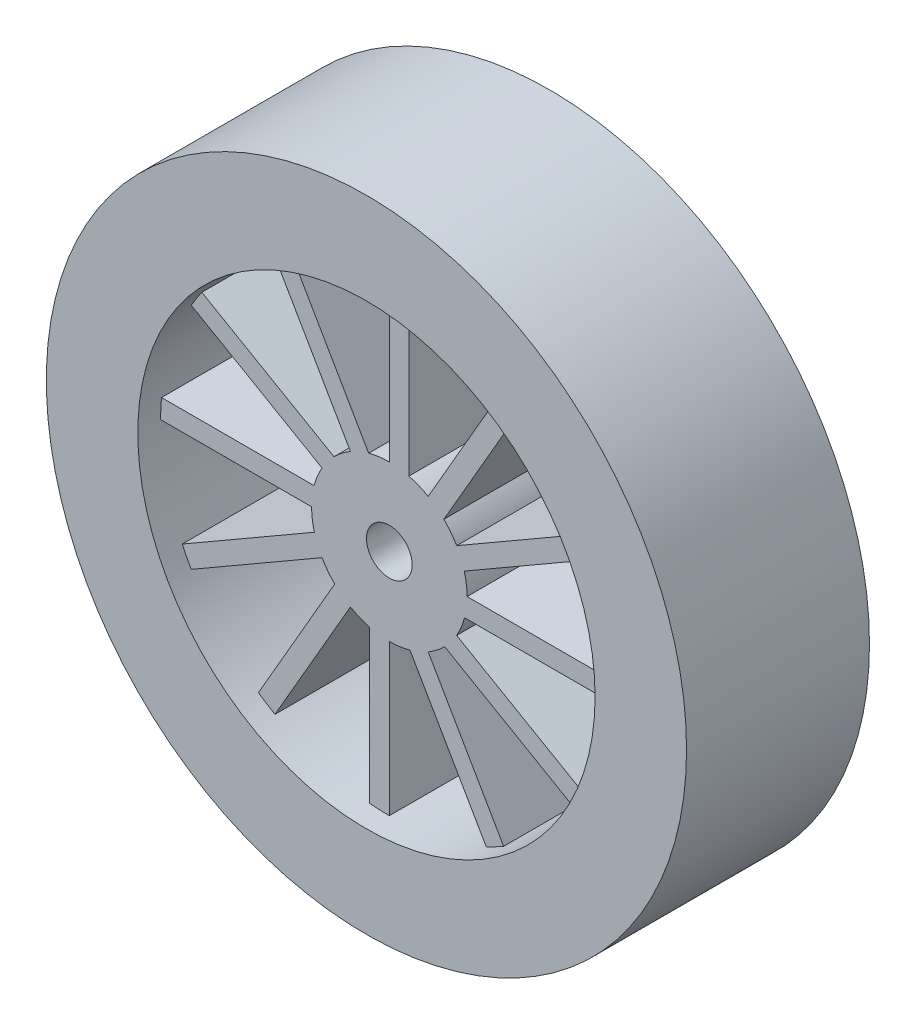
from build123d import *

# Parameters (mm, degrees)
BOSS_EXTRUDE1_DEPTH    = 7.5
BOSS_EXTRUDE1_2_DEPTH  = 7.5
BOSS_EXTRUDE1_3_DEPTH  = 7.5
BOSS_EXTRUDE1_4_DEPTH  = 7.5
BOSS_EXTRUDE1_5_DEPTH  = 7.5
BOSS_EXTRUDE1_6_DEPTH  = 7.5
BOSS_EXTRUDE1_7_DEPTH  = 7.5
BOSS_EXTRUDE1_8_DEPTH  = 7.5
BOSS_EXTRUDE1_9_DEPTH  = 7.5
BOSS_EXTRUDE1_10_DEPTH = 7.5
BOSS_EXTRUDE1_11_DEPTH = 7.5
BOSS_EXTRUDE1_12_DEPTH = 7.5
SKETCH1_3_R            = 27
BOSS_EXTRUDE2_DEPTH    = 10
SKETCH1_4_R            = 7.5
BOSS_EXTRUDE3_DEPTH    = 7.5
SKETCH1_5_R            = 35
SKETCH1_5_R_2          = 27
BOSS_EXTRUDE4_DEPTH    = 10
SKETCH1_6_R            = 7.5
SKETCH1_6_R_2          = 2.5
BOSS_EXTRUDE5_DEPTH    = 7.5


with BuildPart() as part:
    # Sketch1 → Boss-Extrude1 (new, symmetric)
    with BuildSketch(Plane.XY):
        with BuildLine():
            Line((-25, 0), (-8.5, 0))
            ThreePointArc((-8.5, 0), (-8.43117662, 1.079472466), (-8.225820987, 2.141464239))
            Line((-8.225820987, 2.141464239), (-24.908113757, 2.141464239))
            ThreePointArc((-24.908113757, 2.141464239), (-24.977017876, 1.071717333), (-25, 0))
        make_face()
    extrude(amount=BOSS_EXTRUDE1_DEPTH, both=True)



with BuildPart() as body_2:
    # Sketch1 → Boss-Extrude1 2 (new, symmetric)
    with BuildSketch(Plane.XY):
        with BuildLine():
            ThreePointArc((-7.361215932, -4.25), (-7.84134937, -3.280737732), (-8.194502061, -2.258348061))
            Line((-8.194502061, -2.258348061), (-22.641791393, -10.599494446))
            ThreePointArc((-22.641791393, -10.599494446), (-22.166590658, -11.560374502), (-21.650635095, -12.5))
            Line((-21.650635095, -12.5), (-7.361215932, -4.25))
        make_face()
    extrude(amount=BOSS_EXTRUDE1_2_DEPTH, both=True)


with BuildPart() as body_3:
    # Sketch1 → Boss-Extrude1 3 (new, symmetric)
    with BuildSketch(Plane.XY):
        with BuildLine():
            Line((-21.650635095, 12.5), (-7.361215932, 4.25))
            ThreePointArc((-7.361215932, 4.25), (-6.761876904, 5.150438888), (-6.053037822, 5.967472926))
            Line((-6.053037822, 5.967472926), (-20.500327154, 14.308619311))
            ThreePointArc((-20.500327154, 14.308619311), (-21.094873324, 13.416643374), (-21.650635095, 12.5))
        make_face()
    extrude(amount=BOSS_EXTRUDE1_3_DEPTH, both=True)


with BuildPart() as body_4:
    # Sketch1 → Boss-Extrude1 4 (new, symmetric)
    with BuildSketch(Plane.XY):
        with BuildLine():
            ThreePointArc((-4.25, -7.361215932), (-5.150438888, -6.761876904), (-5.967472926, -6.053037822))
            Line((-5.967472926, -6.053037822), (-14.308619311, -20.500327154))
            ThreePointArc((-14.308619311, -20.500327154), (-13.416643374, -21.094873324), (-12.5, -21.650635095))
            Line((-12.5, -21.650635095), (-4.25, -7.361215932))
        make_face()
    extrude(amount=BOSS_EXTRUDE1_4_DEPTH, both=True)


with BuildPart() as body_5:
    # Sketch1 → Boss-Extrude1 5 (new, symmetric)
    with BuildSketch(Plane.XY):
        with BuildLine():
            Line((-12.5, 21.650635095), (-4.25, 7.361215932))
            ThreePointArc((-4.25, 7.361215932), (-3.280737732, 7.84134937), (-2.258348061, 8.194502061))
            Line((-2.258348061, 8.194502061), (-10.599494446, 22.641791393))
            ThreePointArc((-10.599494446, 22.641791393), (-11.560374502, 22.166590658), (-12.5, 21.650635095))
        make_face()
    extrude(amount=BOSS_EXTRUDE1_5_DEPTH, both=True)


with BuildPart() as body_6:
    # Sketch1 → Boss-Extrude1 6 (new, symmetric)
    with BuildSketch(Plane.XY):
        with BuildLine():
            ThreePointArc((0, -8.5), (-1.079472466, -8.43117662), (-2.141464239, -8.225820987))
            Line((-2.141464239, -8.225820987), (-2.141464239, -24.908113757))
            ThreePointArc((-2.141464239, -24.908113757), (-1.071717333, -24.977017876), (0, -25))
            Line((0, -25), (0, -8.5))
        make_face()
    extrude(amount=BOSS_EXTRUDE1_6_DEPTH, both=True)


with BuildPart() as body_7:
    # Sketch1 → Boss-Extrude1 7 (new, symmetric)
    with BuildSketch(Plane.XY):
        with BuildLine():
            Line((0, 25), (0, 8.5))
            ThreePointArc((0, 8.5), (1.079472466, 8.43117662), (2.141464239, 8.225820987))
            Line((2.141464239, 8.225820987), (2.141464239, 24.908113757))
            ThreePointArc((2.141464239, 24.908113757), (1.071717333, 24.977017876), (0, 25))
        make_face()
    extrude(amount=BOSS_EXTRUDE1_7_DEPTH, both=True)


with BuildPart() as body_8:
    # Sketch1 → Boss-Extrude1 8 (new, symmetric)
    with BuildSketch(Plane.XY):
        with BuildLine():
            ThreePointArc((4.25, -7.361215932), (3.280737732, -7.84134937), (2.258348061, -8.194502061))
            Line((2.258348061, -8.194502061), (10.599494446, -22.641791393))
            ThreePointArc((10.599494446, -22.641791393), (11.560374502, -22.166590658), (12.5, -21.650635095))
            Line((12.5, -21.650635095), (4.25, -7.361215932))
        make_face()
    extrude(amount=BOSS_EXTRUDE1_8_DEPTH, both=True)


with BuildPart() as body_9:
    # Sketch1 → Boss-Extrude1 9 (new, symmetric)
    with BuildSketch(Plane.XY):
        with BuildLine():
            Line((12.5, 21.650635095), (4.25, 7.361215932))
            ThreePointArc((4.25, 7.361215932), (5.150438888, 6.761876904), (5.967472926, 6.053037822))
            Line((5.967472926, 6.053037822), (14.308619311, 20.500327154))
            ThreePointArc((14.308619311, 20.500327154), (13.416643374, 21.094873324), (12.5, 21.650635095))
        make_face()
    extrude(amount=BOSS_EXTRUDE1_9_DEPTH, both=True)


with BuildPart() as body_10:
    # Sketch1 → Boss-Extrude1 10 (new, symmetric)
    with BuildSketch(Plane.XY):
        with BuildLine():
            ThreePointArc((7.361215932, -4.25), (6.761876904, -5.150438888), (6.053037822, -5.967472926))
            Line((6.053037822, -5.967472926), (20.500327154, -14.308619311))
            ThreePointArc((20.500327154, -14.308619311), (21.094873324, -13.416643374), (21.650635095, -12.5))
            Line((21.650635095, -12.5), (7.361215932, -4.25))
        make_face()
    extrude(amount=BOSS_EXTRUDE1_10_DEPTH, both=True)


with BuildPart() as body_11:
    # Sketch1 → Boss-Extrude1 11 (new, symmetric)
    with BuildSketch(Plane.XY):
        with BuildLine():
            Line((21.650635095, 12.5), (7.361215932, 4.25))
            ThreePointArc((7.361215932, 4.25), (7.84134937, 3.280737732), (8.194502061, 2.258348061))
            Line((8.194502061, 2.258348061), (22.641791393, 10.599494446))
            ThreePointArc((22.641791393, 10.599494446), (22.166590658, 11.560374502), (21.650635095, 12.5))
        make_face()
    extrude(amount=BOSS_EXTRUDE1_11_DEPTH, both=True)


with BuildPart() as body_12:
    # Sketch1 → Boss-Extrude1 12 (new, symmetric)
    with BuildSketch(Plane.XY):
        with BuildLine():
            ThreePointArc((8.5, 0), (8.43117662, -1.079472466), (8.225820987, -2.141464239))
            Line((8.225820987, -2.141464239), (24.908113757, -2.141464239))
            ThreePointArc((24.908113757, -2.141464239), (24.977017876, -1.071717333), (25, 0))
            Line((25, 0), (8.5, 0))
        make_face()
    extrude(amount=BOSS_EXTRUDE1_12_DEPTH, both=True)


with BuildPart() as part_1:
    add(part.part)

    add(body_2.part)  # Boss-Extrude2 merges body 2

    add(body_3.part)  # Boss-Extrude2 merges body 3

    add(body_4.part)  # Boss-Extrude2 merges body 4

    add(body_5.part)  # Boss-Extrude2 merges body 5

    add(body_6.part)  # Boss-Extrude2 merges body 6

    add(body_7.part)  # Boss-Extrude2 merges body 7

    add(body_8.part)  # Boss-Extrude2 merges body 8

    add(body_9.part)  # Boss-Extrude2 merges body 9

    add(body_10.part)  # Boss-Extrude2 merges body 10

    add(body_11.part)  # Boss-Extrude2 merges body 11

    add(body_12.part)  # Boss-Extrude2 merges body 12
    # Sketch1<3> → Boss-Extrude2 (add, symmetric)
    with BuildSketch(Plane.XY):
        Circle(SKETCH1_3_R)
        with BuildLine():
            ThreePointArc((-22.641791393, -10.599494446), (-24.403327487, -5.429328465), (-25, 0))
            ThreePointArc((-25, 0), (-24.977017876, 1.071717333), (-24.908113757, 2.141464239))
            ThreePointArc((-24.908113757, 2.141464239), (-23.848565773, 7.499727367), (-21.650635095, 12.5))
            ThreePointArc((-21.650635095, 12.5), (-21.094873324, 13.416643374), (-20.500327154, 14.308619311))
            ThreePointArc((-20.500327154, 14.308619311), (-16.90360012, 18.419237307), (-12.5, 21.650635095))
            ThreePointArc((-12.5, 21.650635095), (-11.560374502, 22.166590658), (-10.599494446, 22.641791393))
            ThreePointArc((-10.599494446, 22.641791393), (-5.429328465, 24.403327487), (0, 25))
            ThreePointArc((0, 25), (1.071717333, 24.977017876), (2.141464239, 24.908113757))
            ThreePointArc((2.141464239, 24.908113757), (7.499727367, 23.848565773), (12.5, 21.650635095))
            ThreePointArc((12.5, 21.650635095), (13.416643374, 21.094873324), (14.308619311, 20.500327154))
            ThreePointArc((14.308619311, 20.500327154), (18.419237307, 16.90360012), (21.650635095, 12.5))
            ThreePointArc((21.650635095, 12.5), (22.166590658, 11.560374502), (22.641791393, 10.599494446))
            ThreePointArc((22.641791393, 10.599494446), (24.403327487, 5.429328465), (25, 0))
            ThreePointArc((25, 0), (24.977017876, -1.071717333), (24.908113757, -2.141464239))
            ThreePointArc((24.908113757, -2.141464239), (23.848565773, -7.499727367), (21.650635095, -12.5))
            ThreePointArc((21.650635095, -12.5), (21.094873324, -13.416643374), (20.500327154, -14.308619311))
            ThreePointArc((20.500327154, -14.308619311), (16.90360012, -18.419237307), (12.5, -21.650635095))
            ThreePointArc((12.5, -21.650635095), (11.560374502, -22.166590658), (10.599494446, -22.641791393))
            ThreePointArc((10.599494446, -22.641791393), (5.429328465, -24.403327487), (0, -25))
            ThreePointArc((0, -25), (-1.071717333, -24.977017876), (-2.141464239, -24.908113757))
            ThreePointArc((-2.141464239, -24.908113757), (-7.499727367, -23.848565773), (-12.5, -21.650635095))
            ThreePointArc((-12.5, -21.650635095), (-13.416643374, -21.094873324), (-14.308619311, -20.500327154))
            ThreePointArc((-14.308619311, -20.500327154), (-18.419237307, -16.90360012), (-21.650635095, -12.5))
            ThreePointArc((-21.650635095, -12.5), (-22.166590658, -11.560374502), (-22.641791393, -10.599494446))
        make_face(mode=Mode.SUBTRACT)
    extrude(amount=BOSS_EXTRUDE2_DEPTH, both=True)

    # Sketch1<4> → Boss-Extrude3 (add, symmetric)
    with BuildSketch(Plane.XY):
        with BuildLine():
            ThreePointArc((-8.225820987, 2.141464239), (-8.43117662, 1.079472466), (-8.5, 0))
            ThreePointArc((-8.5, 0), (-8.423279276, -1.139458748), (-8.194502061, -2.258348061))
            ThreePointArc((-8.194502061, -2.258348061), (-7.84134937, -3.280737732), (-7.361215932, -4.25))
            ThreePointArc((-7.361215932, -4.25), (-6.725044462, -5.198439861), (-5.967472926, -6.053037822))
            ThreePointArc((-5.967472926, -6.053037822), (-5.150438888, -6.761876904), (-4.25, -7.361215932))
            ThreePointArc((-4.25, -7.361215932), (-3.224839415, -7.86450321), (-2.141464239, -8.225820987))
            ThreePointArc((-2.141464239, -8.225820987), (-1.079472466, -8.43117662), (0, -8.5))
            ThreePointArc((0, -8.5), (1.139458748, -8.423279276), (2.258348061, -8.194502061))
            ThreePointArc((2.258348061, -8.194502061), (3.280737732, -7.84134937), (4.25, -7.361215932))
            ThreePointArc((4.25, -7.361215932), (5.198439861, -6.725044462), (6.053037822, -5.967472926))
            ThreePointArc((6.053037822, -5.967472926), (6.761876904, -5.150438888), (7.361215932, -4.25))
            ThreePointArc((7.361215932, -4.25), (7.86450321, -3.224839415), (8.225820987, -2.141464239))
            ThreePointArc((8.225820987, -2.141464239), (8.43117662, -1.079472466), (8.5, 0))
            ThreePointArc((8.5, 0), (8.423279276, 1.139458748), (8.194502061, 2.258348061))
            ThreePointArc((8.194502061, 2.258348061), (7.84134937, 3.280737732), (7.361215932, 4.25))
            ThreePointArc((7.361215932, 4.25), (6.725044462, 5.198439861), (5.967472926, 6.053037822))
            ThreePointArc((5.967472926, 6.053037822), (5.150438888, 6.761876904), (4.25, 7.361215932))
            ThreePointArc((4.25, 7.361215932), (3.224839415, 7.86450321), (2.141464239, 8.225820987))
            ThreePointArc((2.141464239, 8.225820987), (1.079472466, 8.43117662), (0, 8.5))
            ThreePointArc((0, 8.5), (-1.139458748, 8.423279276), (-2.258348061, 8.194502061))
            ThreePointArc((-2.258348061, 8.194502061), (-3.280737732, 7.84134937), (-4.25, 7.361215932))
            ThreePointArc((-4.25, 7.361215932), (-5.198439861, 6.725044462), (-6.053037822, 5.967472926))
            ThreePointArc((-6.053037822, 5.967472926), (-6.761876904, 5.150438888), (-7.361215932, 4.25))
            ThreePointArc((-7.361215932, 4.25), (-7.86450321, 3.224839415), (-8.225820987, 2.141464239))
        make_face()
        Circle(SKETCH1_4_R, mode=Mode.SUBTRACT)
    extrude(amount=BOSS_EXTRUDE3_DEPTH, both=True)

    # Sketch1<5> → Boss-Extrude4 (add, symmetric)
    with BuildSketch(Plane.XY):
        Circle(SKETCH1_5_R)
        Circle(SKETCH1_5_R_2, mode=Mode.SUBTRACT)
    extrude(amount=BOSS_EXTRUDE4_DEPTH, both=True)

    # Sketch1<6> → Boss-Extrude5 (add)
    with BuildSketch(Plane.XY):
        Circle(SKETCH1_6_R)
        Circle(SKETCH1_6_R_2, mode=Mode.SUBTRACT)
    extrude(amount=BOSS_EXTRUDE5_DEPTH)


solid = part_1.part
